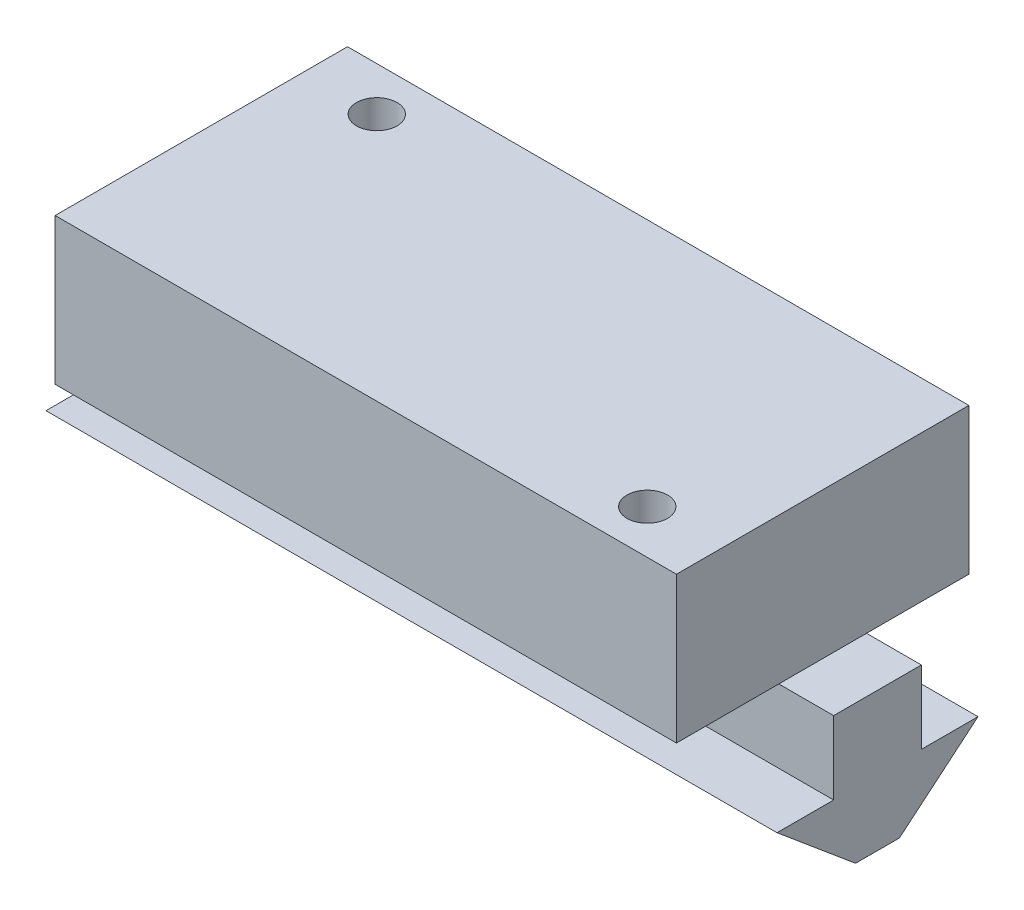
from build123d import *

# Parameters (mm, degrees)
BOSS_EXTRUDE1_DEPTH = 50.8
SKETCH2_W           = 50.8
SKETCH2_H           = 6.096
BOSS_EXTRUDE2_DEPTH = 5.08
SKETCH3_W           = 43.18
SKETCH3_H           = 20.32
BOSS_EXTRUDE3_DEPTH = 10.16
SKETCH4_R           = 1.4097
CUT_EXTRUDE1_DEPTH  = 7.62


with BuildPart() as part:
    # Sketch1 → Boss-Extrude1 (new body)
    with BuildSketch(Plane(origin=(0, 0, 0), x_dir=(0, 0, -1), z_dir=(1, 0, 0))):
        Polygon((0, 0), (3.048, 0), (8.509, 4.572), (-5.461, 4.572), align=None)
    extrude(amount=BOSS_EXTRUDE1_DEPTH)

    # Sketch2 → Boss-Extrude2 (add)
    with BuildSketch(Plane(origin=(0, 4.572, 0), x_dir=(1, 0, 0), z_dir=(0, 1, 0))):
        with Locations((25.4, 1.524)):
            Rectangle(SKETCH2_W, SKETCH2_H)
    extrude(amount=BOSS_EXTRUDE2_DEPTH)

    # Sketch3 → Boss-Extrude3 (add)
    with BuildSketch(Plane(origin=(0, 9.652, 0), x_dir=(1, 0, 0), z_dir=(0, 1, 0))):
        with Locations((25.4, 1.524)):
            Rectangle(SKETCH3_W, SKETCH3_H)
    extrude(amount=BOSS_EXTRUDE3_DEPTH)

    # Sketch4 → Cut-Extrude1 (cut)
    with BuildSketch(Plane(origin=(0, 19.812, 0), x_dir=(1, 0, 0), z_dir=(0, 1, 0))):
        with Locations((41.91, -5.588)):
            Circle(SKETCH4_R)
        with Locations((8.89, 8.636)):
            Circle(SKETCH4_R)
    extrude(amount=-CUT_EXTRUDE1_DEPTH, mode=Mode.SUBTRACT)


solid = part.part
